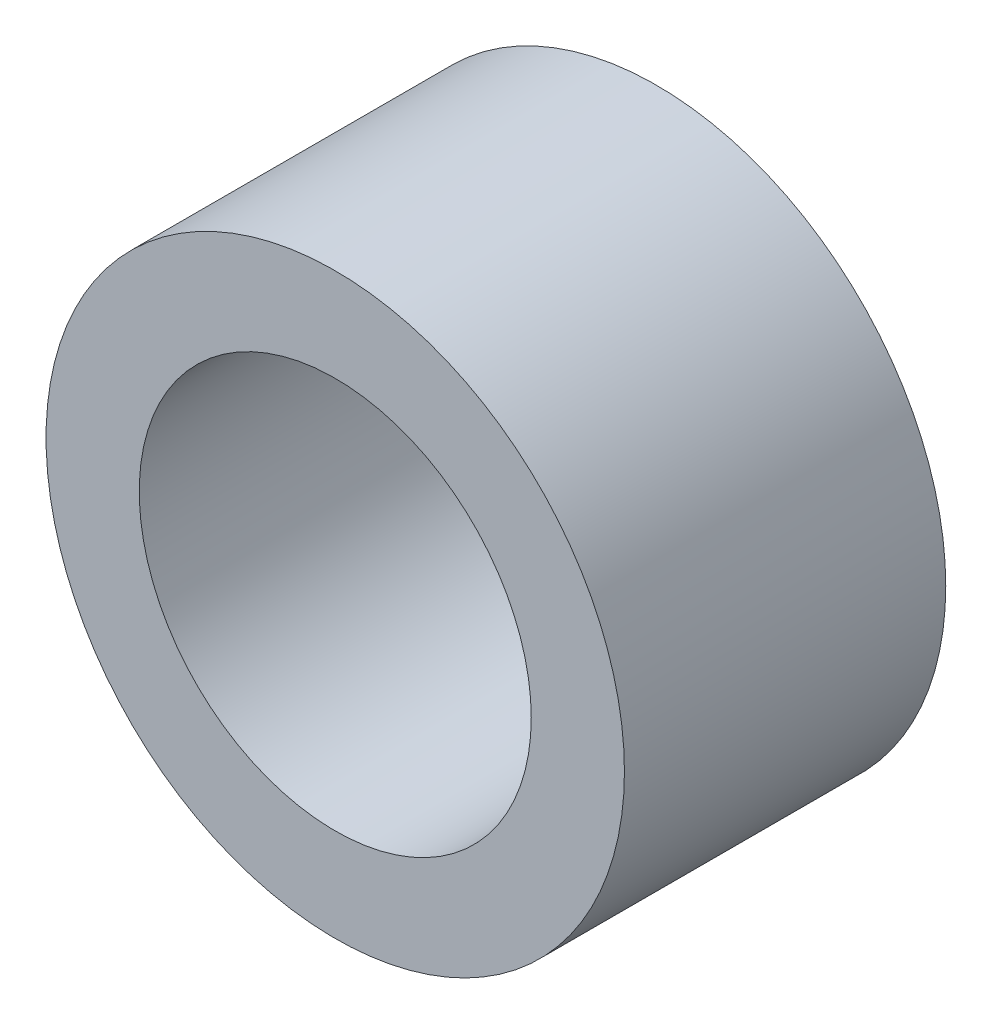
from build123d import *

# Parameters (mm, degrees)
SKETCH1_R           = 4.5
SKETCH1_R_2         = 3.05
BOSS_EXTRUDE1_DEPTH = 5


with BuildPart() as part:
    # Sketch1 → Boss-Extrude1 (new body)
    with BuildSketch(Plane.XY):
        Circle(SKETCH1_R)
        Circle(SKETCH1_R_2, mode=Mode.SUBTRACT)
    extrude(amount=BOSS_EXTRUDE1_DEPTH)


solid = part.part
